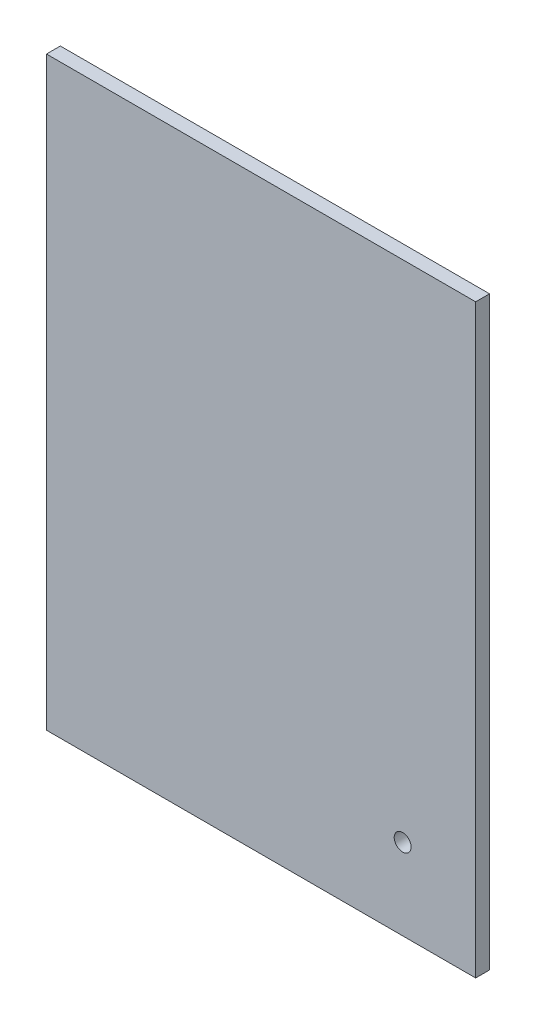
from build123d import *

# Parameters (mm, degrees)
SZKIC1_W                    = 557
SZKIC1_H                    = 760
DODANIE_WYCI_GNI_CIE1_DEPTH = 18
WYTNIJ_WYCI_GNI_CIE1_REACH  = 944.429
SZKIC2_R                    = 10.970397566


with BuildPart() as part:
    # Szkic1 → Dodanie-wyciągnięcie1 (new body)
    with BuildSketch(Plane.XY):
        with Locations((278.5, 380)):
            Rectangle(SZKIC1_W, SZKIC1_H)
    extrude(amount=DODANIE_WYCI_GNI_CIE1_DEPTH)

    # Szkic2 → Wytnij-wyciągnięcie1 (cut, up to next)
    with BuildSketch(Plane.XY.offset(18), mode=Mode.PRIVATE) as wytnij_wyci_gni_cie1_sk1:
        with Locations((462.25415923, 105.191540972)):
            Circle(SZKIC2_R)
    wytnij_wyci_gni_cie1_tool1 = extrude(wytnij_wyci_gni_cie1_sk1.sketch, amount=-WYTNIJ_WYCI_GNI_CIE1_REACH, mode=Mode.PRIVATE) & part.part
    add(wytnij_wyci_gni_cie1_tool1.solids().sort_by_distance((462.254159, 105.191541, 18))[0], mode=Mode.SUBTRACT)


solid = part.part
